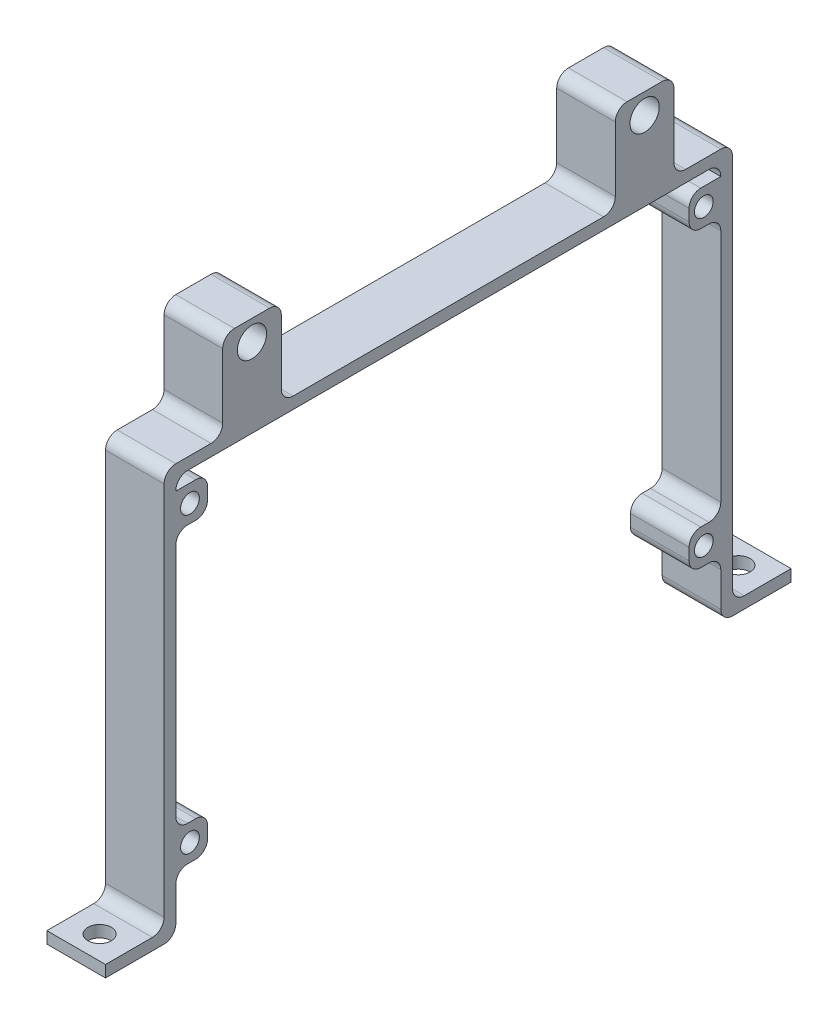
from build123d import *

# Parameters (mm, degrees)
SKETCH1_W             = 10
SKETCH1_H             = 15
SKETCH1_R             = 2.5
BOSS_EXTRUDE1_DEPTH   = 10
FILLET1_R             = 2
F_4_0MM_DOWEL_HOLE1_D = 4
SKETCH4_W             = 5.416503596
SKETCH4_H             = 6
SKETCH4_R             = 1.6
BOSS_EXTRUDE2_DEPTH   = 10
FILLET1_OF_MIRROR1_R  = 2
SKETCH5_W             = 5.416503596
SKETCH5_H             = 6
SKETCH5_R             = 1.6
BOSS_EXTRUDE3_DEPTH   = 10
FILLET2_R             = 2


with BuildPart() as part:
    # Sketch1 → Boss-Extrude1 (new body)
    # profile 1 of 2: a face of its own
    with BuildSketch(Plane(origin=(0, 0, 0), x_dir=(0, 0, -1), z_dir=(1, 0, 0))):
        with Locations((-33.5, 77.5)):
            Rectangle(SKETCH1_W, SKETCH1_H)
        with Locations((-33.5, 81.5)):
            Circle(SKETCH1_R, mode=Mode.SUBTRACT)
    # profile 2 of 2: a face of its own
    with BuildSketch(Plane(origin=(0, 0, 0), x_dir=(0, 0, -1), z_dir=(1, 0, 0))):
        Polygon((-46.5, 68), (0, 68), (0, 70), (-48.5, 70), (-48.5, 2), (-58.5, 2), (-58.5, 0), (-46.5, 0), align=None)
    boss_extrude1 = extrude(amount=BOSS_EXTRUDE1_DEPTH)

    # Fillet1
    fillet1_edges = [part.edges().sort_by_distance(p)[0] for p in [
        (5, 68, 46.5),
        (5, 2, 48.5),
        (5, 70, 48.5),
    ]]
    fillet(fillet1_edges, radius=FILLET1_R)

    # Ø4.0mm Dowel Hole1 (through all)
    with Locations(Plane(origin=(5, 2, 54.5), x_dir=(0, 0, 1), z_dir=(0, 1, 0))):
        with Locations((0, 0)):
            f_4_0mm_dowel_hole1 = Hole(F_4_0MM_DOWEL_HOLE1_D / 2)

    # Sketch4 → Boss-Extrude2 (add)
    # profile 1 of 2: a face of its own
    with BuildSketch(Plane(origin=(10, 0, 0), x_dir=(0, 0, -1), z_dir=(1, 0, 0))):
        with Locations((-43.791748202, 62.946385234)):
            Rectangle(SKETCH4_W, SKETCH4_H)
        with Locations((-44.083496404, 62.946385234)):
            Circle(SKETCH4_R, mode=Mode.SUBTRACT)
    # profile 2 of 2: a face of its own
    with BuildSketch(Plane(origin=(10, 0, 0), x_dir=(0, 0, -1), z_dir=(1, 0, 0))):
        with Locations((-43.791748202, 12.852385234)):
            Rectangle(SKETCH4_W, SKETCH4_H)
        with Locations((-44.083496404, 12.852385234)):
            Circle(SKETCH4_R, mode=Mode.SUBTRACT)
    extrude(amount=-BOSS_EXTRUDE2_DEPTH)

    # Mirror1: Boss-Extrude1, Ø4.0mm Dowel Hole1 across plane
    add(boss_extrude1.mirror(Plane.XY))
    add(f_4_0mm_dowel_hole1.mirror(Plane.XY), mode=Mode.SUBTRACT)

    # Fillet1 of Mirror1
    fillet1_of_mirror1_edges = [part.edges().sort_by_distance(p)[0] for p in [
        (5, 68, -46.5),
        (5, 2, -48.5),
        (5, 70, -48.5),
    ]]
    fillet(fillet1_of_mirror1_edges, radius=FILLET1_OF_MIRROR1_R)

    # Sketch5 → Boss-Extrude3 (add)
    # profile 1 of 2: a face of its own
    with BuildSketch(Plane(origin=(10, 0, 0), x_dir=(0, 0, -1), z_dir=(1, 0, 0))):
        with Locations((43.791748202, 62.946385234)):
            Rectangle(SKETCH5_W, SKETCH5_H)
        with Locations((43.602503596, 62.946385234)):
            Circle(SKETCH5_R, mode=Mode.SUBTRACT)
    # profile 2 of 2: a face of its own
    with BuildSketch(Plane(origin=(10, 0, 0), x_dir=(0, 0, -1), z_dir=(1, 0, 0))):
        with Locations((43.791748202, 12.852385234)):
            Rectangle(SKETCH5_W, SKETCH5_H)
        with Locations((43.602503596, 12.852385234)):
            Circle(SKETCH5_R, mode=Mode.SUBTRACT)
    extrude(amount=-BOSS_EXTRUDE3_DEPTH)

    # Fillet2
    fillet2_edges = [part.edges().sort_by_distance(p)[0] for p in [
        (5, 70, -38.5),
        (5, 85, -38.5),
        (5, 85, -28.5),
        (5, 70, -28.5),
        (5, 0, -46.5),
        (5, 65.946385234, -41.083496404),
        (5, 59.946385234, -41.083496404),
        (5, 59.946385234, -46.5),
        (5, 15.852385234, -46.5),
        (5, 15.852385234, -41.083496404),
        (5, 9.852385234, -41.083496404),
        (5, 9.852385234, -46.5),
        (5, 85, 38.5),
        (5, 85, 28.5),
        (5, 70, 28.5),
        (5, 0, 46.5),
        (5, 70, 38.5),
        (5, 65.946385234, 41.083496404),
        (5, 59.946385234, 41.083496404),
        (5, 59.946385234, 46.5),
        (5, 15.852385234, 41.083496404),
        (5, 15.852385234, 46.5),
        (5, 9.852385234, 46.5),
        (5, 9.852385234, 41.083496404),
    ]]
    fillet(fillet2_edges, radius=FILLET2_R)


solid = part.part
